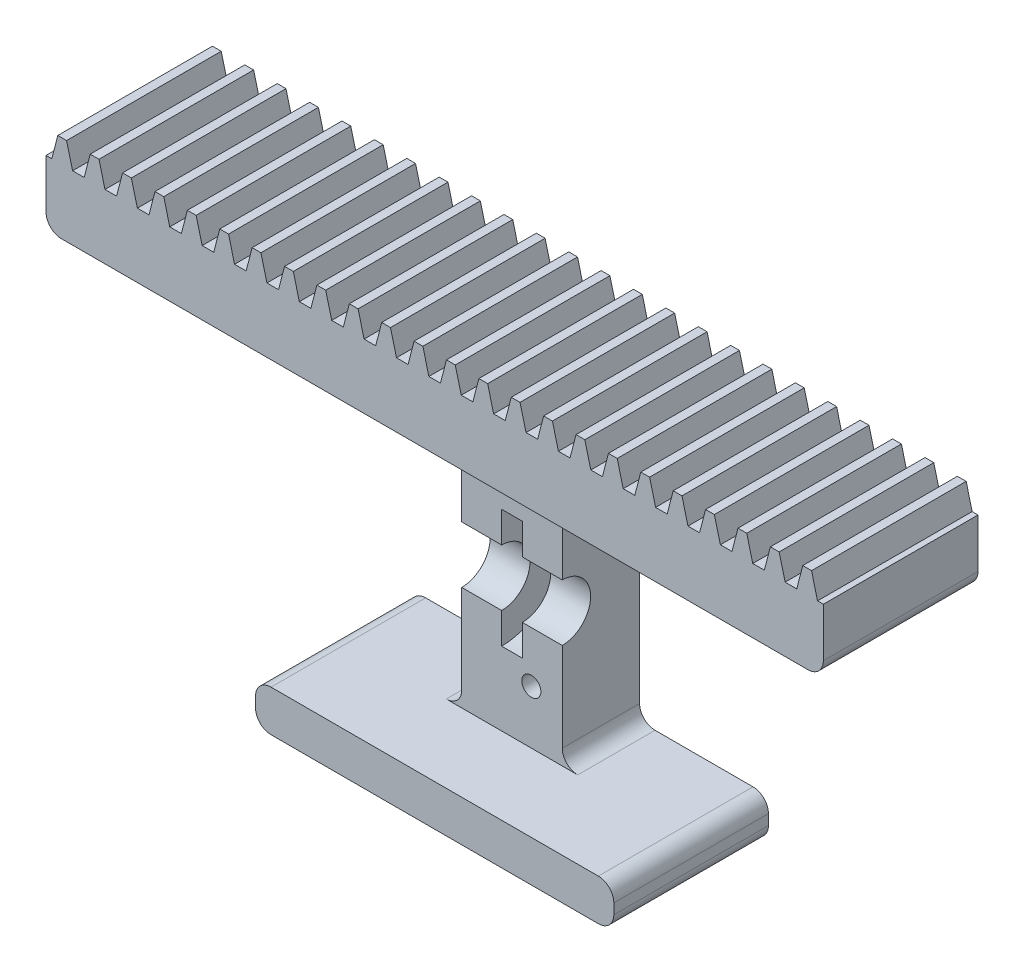
from build123d import *

# Parameters (mm, degrees)
BLANKSKE_W                            = 150.8
BLANKSKE_H                            = 17
BLANK_CREMALHEIRA_DEPTH               = 30
CORTE_DENTE_DIMENSIONADO_DEPTH        = 155.692081245
CORTE_DESTES_COUNT                    = 25
CORTE_DESTES_PITCH                    = 6.2831853
SKETCH1_W                             = 9.75
SKETCH1_H                             = 55
CORPO_DE_APOIO_DEPTH                  = 30
SKETCH2_W                             = 19.5
SKETCH2_H                             = 55
REBAIXO_DEPTH                         = 15
ENCAIXE_FLANGE_11_PASSANTE_DEPTH      = 103.733441488
ENCAIXE_FLANGE_11_PASSANTE_DEPTH_BACK = 103.733441488
SKETCH3_R                             = 5.5
SKETCH3_3_R                           = 11.5
SKETCH3_3_R_2                         = 5.5
ENCAIXE_FLANGE_23X4_DEPTH             = 2
REBAIXOS_DAS_PORCAS_DEPTH             = 4
SKETCH5_R                             = 1.85
FUROS_DE_FIXA_O_DEPTH                 = 166.486071921
RAIOS_3MM_R                           = 3
RAIOS_5MM_R                           = 5


with BuildPart() as part:
    # BlankSke → Blank Cremalheira (new body)
    with BuildSketch(Plane.XY):
        with Locations((75.4, 8.5)):
            Rectangle(BLANKSKE_W, BLANKSKE_H)
    extrude(amount=-BLANK_CREMALHEIRA_DEPTH)

    # TooCutSkeSim → Corte - Dente Dimensionado (cut, through all)
    with BuildSketch(Plane.XY):
        Polygon((1.125252364, 12.5), (-1.125252364, 12.5), (-2.29560038, 17.0254), (2.29560038, 17.0254), align=None)
    corte_dente_dimensionado = extrude(amount=-CORTE_DENTE_DIMENSIONADO_DEPTH, mode=Mode.SUBTRACT)

    # Corte - Destes: Corte - Dente Dimensionado ×25
    with Locations(*[(i * CORTE_DESTES_PITCH, 0, 0) for i in range(1, CORTE_DESTES_COUNT)]):
        add(corte_dente_dimensionado, mode=Mode.SUBTRACT)

    # Sketch1 → Corpo de Apoio (add)
    with BuildSketch(Plane(origin=(0, 0, -30), x_dir=(-1, 0, 0), z_dir=(0, 0, -1))):
        with Locations((-70.525, -27.5)):
            Rectangle(SKETCH1_W, SKETCH1_H)
        with Locations((-80.275, -27.5)):
            Rectangle(SKETCH1_W, SKETCH1_H)
        Polygon((-65.65, -55), (-75.4, -55), (-75.4, -63), (-40.65, -63), (-40.65, -55), align=None)
        Polygon((-75.4, -63), (-75.4, -55), (-85.15, -55), (-110.15, -55), (-110.15, -63), align=None)
    extrude(amount=-CORPO_DE_APOIO_DEPTH)

    # Sketch2 → Rebaixo (cut)
    with BuildSketch(Plane.XY):
        with Locations((75.4, -27.5)):
            Rectangle(SKETCH2_W, SKETCH2_H)
    extrude(amount=-REBAIXO_DEPTH, mode=Mode.SUBTRACT)

    # Sketch3 → Encaixe Flange - Ø11 Passante (cut, two sides: drawn at the far end of the back side and taken through both)
    with BuildSketch(Plane.ZY.offset(-75.4).offset(-ENCAIXE_FLANGE_11_PASSANTE_DEPTH_BACK)):
        with Locations((-15, -29.25)):
            Circle(SKETCH3_R)
    extrude(amount=ENCAIXE_FLANGE_11_PASSANTE_DEPTH + ENCAIXE_FLANGE_11_PASSANTE_DEPTH_BACK, mode=Mode.SUBTRACT)

    # Sketch3<3> → Encaixe Flange - Ø23x4 (cut, symmetric)
    with BuildSketch(Plane.ZY.offset(-75.4)):
        with Locations((-15, -29.25)):
            Circle(SKETCH3_3_R)
        with Locations((-15, -29.25)):
            Circle(SKETCH3_3_R_2, mode=Mode.SUBTRACT)
    extrude(amount=ENCAIXE_FLANGE_23X4_DEPTH, both=True, mode=Mode.SUBTRACT)

    # Sketch4 → Rebaixos das Porcas (cut)
    with BuildSketch(Plane(origin=(0, 0, -30), x_dir=(-1, 0, 0), z_dir=(0, 0, -1))):
        Polygon((-71.65, -3.843078062), (-75.25, -5.921539031), (-75.25, -10.078460969), (-71.65, -12.156921938), (-68.05, -10.078460969), (-68.05, -5.921539031), align=None)
        Polygon((-79.15, -40.443072948), (-82.75, -42.521533917), (-82.75, -46.678455855), (-79.15, -48.756916824), (-75.55, -46.678455855), (-75.55, -42.521533917), align=None)
    extrude(amount=-REBAIXOS_DAS_PORCAS_DEPTH, mode=Mode.SUBTRACT)

    # Sketch5 → Furos de Fixação (cut, through all)
    with BuildSketch(Plane(origin=(0, 0, -26), x_dir=(-1, 0, 0), z_dir=(0, 0, -1))):
        with Locations((-79.15, -44.599994886)):
            Circle(SKETCH5_R)
        with Locations((-71.65, -8)):
            Circle(SKETCH5_R)
    extrude(amount=-FUROS_DE_FIXA_O_DEPTH, mode=Mode.SUBTRACT)

    # Raios 3mm
    raios_3mm_edges = [part.edges().sort_by_distance(p)[0] for p in [
        (40.65, -55, -15),
        (40.65, -63, -15),
        (110.15, -63, -15),
        (110.15, -55, -15),
        (85.15, -55, -22.5),
        (65.65, -55, -22.5),
        (150.8, 0, -15),
        (0, 0, -15),
    ]]
    fillet(raios_3mm_edges, radius=RAIOS_3MM_R)

    # Raios 5mm
    raios_5mm_edges = [part.edges().sort_by_distance(p)[0] for p in [
        (85.15, 0, -22.5),
        (65.65, 0, -22.5),
    ]]
    fillet(raios_5mm_edges, radius=RAIOS_5MM_R)


solid = part.part
